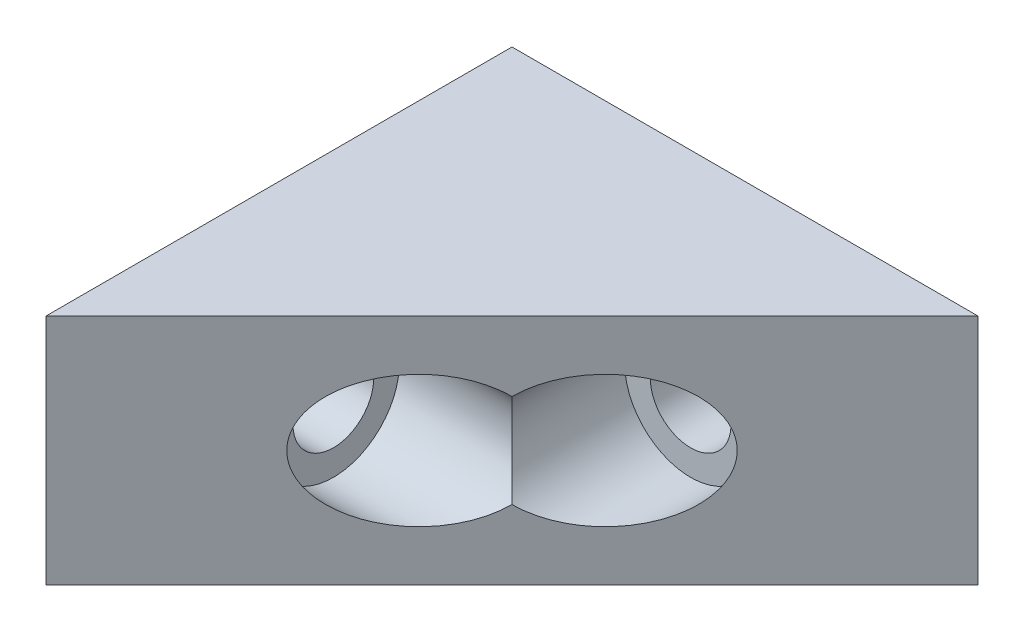
from build123d import *

# Parameters (mm, degrees)
EXTRUDE_1_DEPTH          = 15
SKETCH_2_R               = 2.6
CUT_EXTRUDE_1_DEPTH      = 42.374516613
SKETCH_3_R               = 2.6
CUT_EXTRUDE_2_DEPTH      = 37.793554123
CUT_EXTRUDE_4_DEPTH      = 3.5
CUT_EXTRUDE_4_DEPTH_BACK = 14
SKETCH_5_R               = 4.25
CUT_EXTRUDE_5_DEPTH      = 3.5
CUT_EXTRUDE_5_DEPTH_BACK = 18
SKETCH_6_R               = 4.25


with BuildPart() as part:
    # 草图1 → 凸台-拉伸1 (new body)
    with BuildSketch(Plane(origin=(0, 0, 0), x_dir=(1, 0, 0), z_dir=(0, 1, 0))):
        Polygon((14.875, 5.775), (-15.125, -24.225), (-15.125, 5.775), align=None)
    extrude(amount=EXTRUDE_1_DEPTH)

    # 草图2 → 切除-拉伸1 (cut, through all)
    with BuildSketch(Plane.ZY.offset(15.125)):
        with Locations((12.225, 7.5)):
            Circle(SKETCH_2_R)
    extrude(amount=-CUT_EXTRUDE_1_DEPTH, mode=Mode.SUBTRACT)

    # 草图3 → 切除-拉伸2 (cut, through all)
    with BuildSketch(Plane(origin=(0, 0, -5.775), x_dir=(-1, 0, 0), z_dir=(0, 0, -1))):
        with Locations((-2.875, 7.5)):
            Circle(SKETCH_3_R)
    extrude(amount=-CUT_EXTRUDE_2_DEPTH, mode=Mode.SUBTRACT)

    # 草图5 → 切除-拉伸4 (cut, two sides: drawn at the far end of the back side and taken through both)
    with BuildSketch(Plane.ZY.offset(5.125).offset(-CUT_EXTRUDE_4_DEPTH_BACK)):
        with Locations(Location((12.225, 7.5, 0), (0, 0, 180))):
            Circle(SKETCH_5_R)
    extrude(amount=CUT_EXTRUDE_4_DEPTH + CUT_EXTRUDE_4_DEPTH_BACK, mode=Mode.SUBTRACT)

    # 草图6 → 切除-拉伸5 (cut, two sides: drawn at the far end of the back side and taken through both)
    with BuildSketch(Plane(origin=(0, 0, 4.225), x_dir=(-1, 0, 0), z_dir=(0, 0, -1)).offset(-CUT_EXTRUDE_5_DEPTH_BACK)):
        with Locations(Location((-2.875, 7.5, 0), (0, 0, 45.099127844))):
            Circle(SKETCH_6_R)
    extrude(amount=CUT_EXTRUDE_5_DEPTH + CUT_EXTRUDE_5_DEPTH_BACK, mode=Mode.SUBTRACT)


solid = part.part
